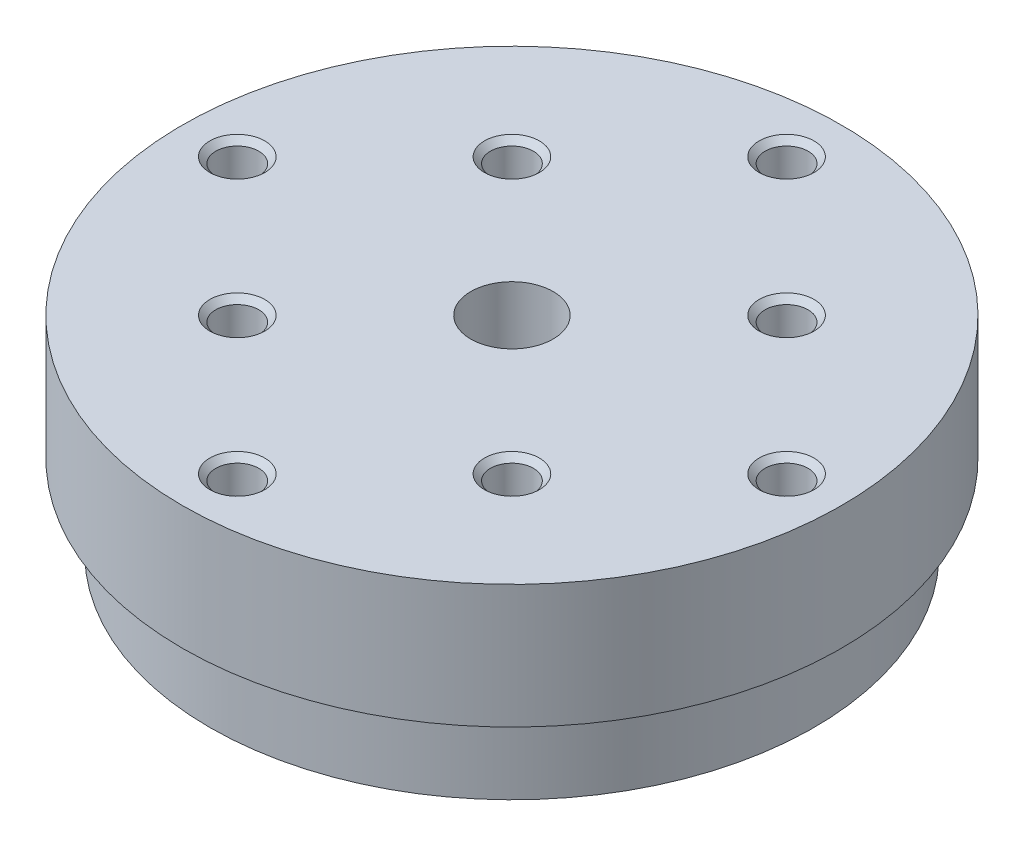
from build123d import *

# Parameters (mm, degrees)
SKETCH_2_W                  = 1.5
SKETCH_2_H                  = 15
PATTERN_LINEAR_1_COUNT      = 3
PATTERN_LINEAR_1_PITCH      = 7.071067812
PATTERN_LINEAR_1_COUNT_DIR2 = 3
PATTERN_LINEAR_1_PITCH_DIR2 = 7.071067812


with BuildPart() as part:
    # 草图1 → 旋转1 (revolve)
    with BuildSketch(Plane.XY):
        Polygon((0, 4.5), (12, 4.5), (12, 0), (11, 0), (11, -3), (0, -3), align=None)
    revolve(axis=Axis((0, -3, 0), (0, 1, 0)))

    # 草图2 → 切除-旋转1 (revolve, cut)
    with BuildSketch(Plane.XY):
        with Locations((0.75, -3)):
            Rectangle(SKETCH_2_W, SKETCH_2_H)
    revolve(axis=Axis((0, -10.5, 0), (0, 1, 0)), mode=Mode.SUBTRACT)

    # 草图3 → 切除-旋转2 (revolve, cut)
    with BuildSketch(Plane.XY):
        Polygon((10, 4.5), (11, 4.5), (10.7835, 4.2835), (10.7835, 1.202353936), (10, 0.75), align=None)
    cut_revolve_2 = revolve(axis=Axis((10, 0.75, 0), (0, 1, 0)), mode=Mode.SUBTRACT)

    # 阵列(线性)1: Cut-Revolve 2 3 × 3, 1 skipped
    with Locations(*[Vector(-0.7071067811865475, 0, -0.7071067811865476) * (i * PATTERN_LINEAR_1_PITCH) + Vector(-0.7071067811865477, 0, 0.7071067811865475) * (j * PATTERN_LINEAR_1_PITCH_DIR2) for i in range(PATTERN_LINEAR_1_COUNT) for j in range(PATTERN_LINEAR_1_COUNT_DIR2) if (i, j) not in ((0, 0), (1, 1))]):
        add(cut_revolve_2, mode=Mode.SUBTRACT)


solid = part.part
